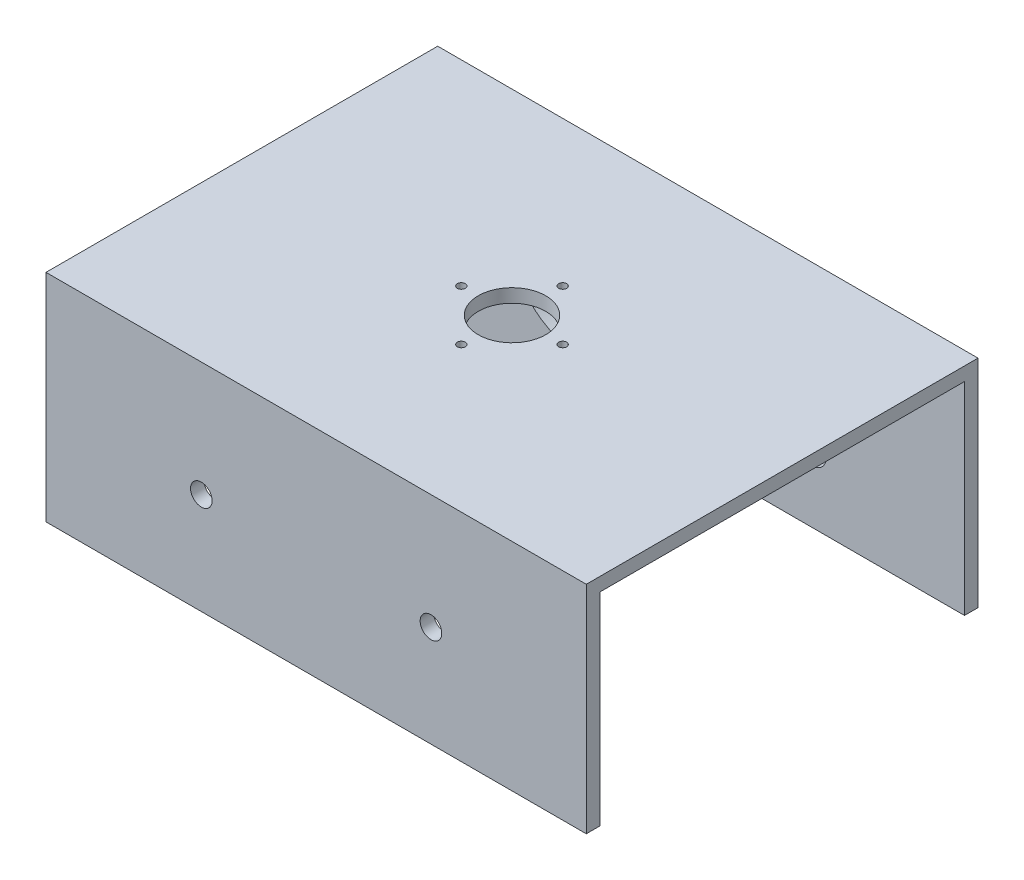
from build123d import *

# Parameters (mm, degrees)
SKETCH_1_W          = 80
SKETCH_1_H          = 30
EXTRUDE_1_DEPTH     = 2
SKETCH_2_W          = 80
SKETCH_2_H          = 58
EXTRUDE_2_DEPTH     = 2
SKETCH_3_W          = 80
SKETCH_3_H          = 2
EXTRUDE_3_DEPTH     = 30
CUT_EXTRUDE_1_REACH = 77.895
SKETCH_5_R          = 5
SKETCH_5_R_2        = 0.6
CUT_EXTRUDE_3_REACH = 74.478
SKETCH_6_R          = 1.6
CUT_EXTRUDE_4_REACH = 74.478
SKETCH_7_R          = 10.1
CUT_EXTRUDE_5_REACH = 72.887
SKETCH_8_R          = 2.1
CUT_EXTRUDE_6_REACH = 72.887
SKETCH_9_R          = 2.1


with BuildPart() as part:
    # 草图1 → 凸台-拉伸1 (new body)
    with BuildSketch(Plane.XY):
        Rectangle(SKETCH_1_W, SKETCH_1_H)
    extrude(amount=EXTRUDE_1_DEPTH)

    # 草图2 → 凸台-拉伸2 (add)
    with BuildSketch(Plane(origin=(0, 15, 0), x_dir=(1, 0, 0), z_dir=(0, 1, 0))):
        with Locations((0, 27)):
            Rectangle(SKETCH_2_W, SKETCH_2_H)
    extrude(amount=EXTRUDE_2_DEPTH)

    # 草图3 → 凸台-拉伸3 (add)
    with BuildSketch(Plane.XZ.offset(-15)):
        with Locations((0, -55)):
            Rectangle(SKETCH_3_W, SKETCH_3_H)
    extrude(amount=EXTRUDE_3_DEPTH)

    # 草图5 → 切除-拉伸1 (cut, up to next)
    with BuildSketch(Plane(origin=(0, 17, 0), x_dir=(1, 0, 0), z_dir=(0, 1, 0)), mode=Mode.PRIVATE) as cut_extrude_1_sk1:
        with Locations(Location((0, 27, 0), (0, 0, 270))):
            Circle(SKETCH_5_R)
    cut_extrude_1_tool1 = extrude(cut_extrude_1_sk1.sketch, amount=-CUT_EXTRUDE_1_REACH, mode=Mode.PRIVATE) & part.part
    # 草图5 → 切除-拉伸1 (cut, up to next)
    with BuildSketch(Plane(origin=(0, 17, 0), x_dir=(1, 0, 0), z_dir=(0, 1, 0)), mode=Mode.PRIVATE) as cut_extrude_1_sk2:
        with Locations(Location((-7.5, 27, 0), (0, 0, 270))):
            Circle(SKETCH_5_R_2)
    cut_extrude_1_tool2 = extrude(cut_extrude_1_sk2.sketch, amount=-CUT_EXTRUDE_1_REACH, mode=Mode.PRIVATE) & part.part
    # 草图5 → 切除-拉伸1 (cut, up to next)
    with BuildSketch(Plane(origin=(0, 17, 0), x_dir=(1, 0, 0), z_dir=(0, 1, 0)), mode=Mode.PRIVATE) as cut_extrude_1_sk3:
        with Locations(Location((7.5, 27, 0), (0, 0, 270))):
            Circle(SKETCH_5_R_2)
    cut_extrude_1_tool3 = extrude(cut_extrude_1_sk3.sketch, amount=-CUT_EXTRUDE_1_REACH, mode=Mode.PRIVATE) & part.part
    # 草图5 → 切除-拉伸1 (cut, up to next)
    with BuildSketch(Plane(origin=(0, 17, 0), x_dir=(1, 0, 0), z_dir=(0, 1, 0)), mode=Mode.PRIVATE) as cut_extrude_1_sk4:
        with Locations(Location((0, 34.5, 0), (0, 0, 270))):
            Circle(SKETCH_5_R_2)
    cut_extrude_1_tool4 = extrude(cut_extrude_1_sk4.sketch, amount=-CUT_EXTRUDE_1_REACH, mode=Mode.PRIVATE) & part.part
    # 草图5 → 切除-拉伸1 (cut, up to next)
    with BuildSketch(Plane(origin=(0, 17, 0), x_dir=(1, 0, 0), z_dir=(0, 1, 0)), mode=Mode.PRIVATE) as cut_extrude_1_sk5:
        with Locations(Location((0, 19.5, 0), (0, 0, 270))):
            Circle(SKETCH_5_R_2)
    cut_extrude_1_tool5 = extrude(cut_extrude_1_sk5.sketch, amount=-CUT_EXTRUDE_1_REACH, mode=Mode.PRIVATE) & part.part
    add(cut_extrude_1_tool1.solids().sort_by_distance((0, 17, -27))[0], mode=Mode.SUBTRACT)
    add(cut_extrude_1_tool2.solids().sort_by_distance((-7.5, 17, -27))[0], mode=Mode.SUBTRACT)
    add(cut_extrude_1_tool3.solids().sort_by_distance((7.5, 17, -27))[0], mode=Mode.SUBTRACT)
    add(cut_extrude_1_tool4.solids().sort_by_distance((0, 17, -34.5))[0], mode=Mode.SUBTRACT)
    add(cut_extrude_1_tool5.solids().sort_by_distance((0, 17, -19.5))[0], mode=Mode.SUBTRACT)

    # 切除-拉伸3: up to this face of the body (flat: up to its plane)
    cut_extrude_3_end = Plane(part.part.faces().sort_by_distance((0, 1, 2))[0])
    # 草图6 → 切除-拉伸3 (cut, up to the picked face)
    with BuildSketch(Plane(origin=(0, 0, -56), x_dir=(-1, 0, 0), z_dir=(0, 0, -1)), mode=Mode.PRIVATE) as cut_extrude_3_sk1:
        with Locations((-17, 0)):
            Circle(SKETCH_6_R)
    cut_extrude_3_tool1 = split(extrude(cut_extrude_3_sk1.sketch, amount=-CUT_EXTRUDE_3_REACH, mode=Mode.PRIVATE), bisect_by=cut_extrude_3_end, keep=Keep.BOTH, mode=Mode.PRIVATE)
    # 草图6 → 切除-拉伸3 (cut, up to the picked face)
    with BuildSketch(Plane(origin=(0, 0, -56), x_dir=(-1, 0, 0), z_dir=(0, 0, -1)), mode=Mode.PRIVATE) as cut_extrude_3_sk2:
        with Locations((17, 0)):
            Circle(SKETCH_6_R)
    cut_extrude_3_tool2 = split(extrude(cut_extrude_3_sk2.sketch, amount=-CUT_EXTRUDE_3_REACH, mode=Mode.PRIVATE), bisect_by=cut_extrude_3_end, keep=Keep.BOTH, mode=Mode.PRIVATE)
    add(cut_extrude_3_tool1.solids().sort_by(Axis((17, 0, -56), (0, 0, 1)))[0], mode=Mode.SUBTRACT)
    add(cut_extrude_3_tool2.solids().sort_by(Axis((-17, 0, -56), (0, 0, 1)))[0], mode=Mode.SUBTRACT)

    # 草图7 → 切除-拉伸4 (cut, up to next)
    with BuildSketch(Plane(origin=(0, 0, -56), x_dir=(-1, 0, 0), z_dir=(0, 0, -1)), mode=Mode.PRIVATE) as cut_extrude_4_sk1:
        with Locations((17, 0)):
            Circle(SKETCH_7_R)
    cut_extrude_4_tool1 = extrude(cut_extrude_4_sk1.sketch, amount=-CUT_EXTRUDE_4_REACH, mode=Mode.PRIVATE) & part.part
    add(cut_extrude_4_tool1.solids().sort_by_distance((-17, 0, -56))[0], mode=Mode.SUBTRACT)

    # 草图8 → 切除-拉伸5 (cut, up to next)
    with BuildSketch(Plane.XY.offset(-54), mode=Mode.PRIVATE) as cut_extrude_5_sk1:
        with Locations((17.42, 5)):
            Circle(SKETCH_8_R)
    cut_extrude_5_tool1 = extrude(cut_extrude_5_sk1.sketch, amount=-CUT_EXTRUDE_5_REACH, mode=Mode.PRIVATE) & part.part
    # 草图8 → 切除-拉伸5 (cut, up to next)
    with BuildSketch(Plane.XY.offset(-54), mode=Mode.PRIVATE) as cut_extrude_5_sk2:
        with Locations((17.42, -5)):
            Circle(SKETCH_8_R)
    cut_extrude_5_tool2 = extrude(cut_extrude_5_sk2.sketch, amount=-CUT_EXTRUDE_5_REACH, mode=Mode.PRIVATE) & part.part
    add(cut_extrude_5_tool1.solids().sort_by_distance((17.42, 5, -54))[0], mode=Mode.SUBTRACT)
    add(cut_extrude_5_tool2.solids().sort_by_distance((17.42, -5, -54))[0], mode=Mode.SUBTRACT)

    # 草图9 → 切除-拉伸6 (cut, up to next)
    with BuildSketch(Plane.XY.offset(-54), mode=Mode.PRIVATE) as cut_extrude_6_sk1:
        with Locations((-32.07, 5)):
            Circle(SKETCH_9_R)
    cut_extrude_6_tool1 = extrude(cut_extrude_6_sk1.sketch, amount=-CUT_EXTRUDE_6_REACH, mode=Mode.PRIVATE) & part.part
    # 草图9 → 切除-拉伸6 (cut, up to next)
    with BuildSketch(Plane.XY.offset(-54), mode=Mode.PRIVATE) as cut_extrude_6_sk2:
        with Locations((-32.07, -5)):
            Circle(SKETCH_9_R)
    cut_extrude_6_tool2 = extrude(cut_extrude_6_sk2.sketch, amount=-CUT_EXTRUDE_6_REACH, mode=Mode.PRIVATE) & part.part
    add(cut_extrude_6_tool1.solids().sort_by_distance((-32.07, 5, -54))[0], mode=Mode.SUBTRACT)
    add(cut_extrude_6_tool2.solids().sort_by_distance((-32.07, -5, -54))[0], mode=Mode.SUBTRACT)


solid = part.part
